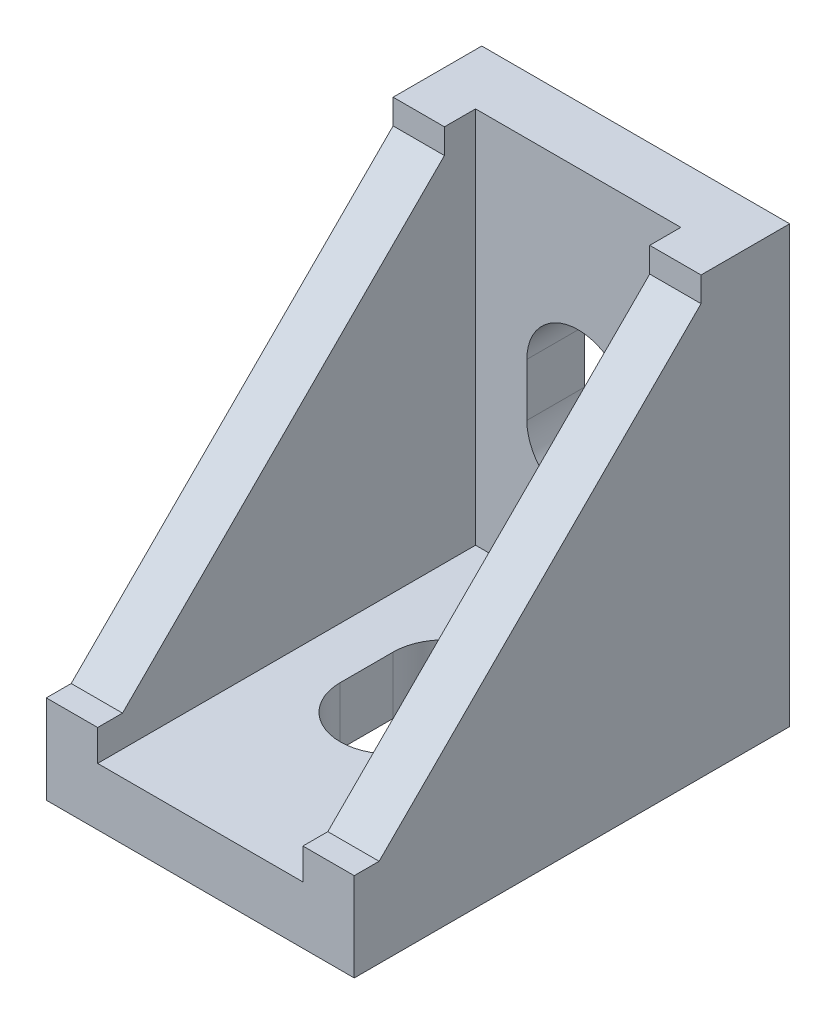
from build123d import *

# Parameters (mm, degrees)
SKETCH1_W           = 19.8
SKETCH1_H           = 28
BOSS_EXTRUDE1_DEPTH = 3.7
SKETCH2_W           = 19.8
SKETCH2_H           = 3.7
BOSS_EXTRUDE2_DEPTH = 24.3
CUT_EXTRUDE1_DEPTH  = 9
BOSS_EXTRUDE3_DEPTH = 3.3
BOSS_EXTRUDE4_DEPTH = 3.3
BOSS_EXTRUDE5_DEPTH = 2.1
BOSS_EXTRUDE6_DEPTH = 1.5


with BuildPart() as part:
    # Sketch1 → Boss-Extrude1 (new body)
    with BuildSketch(Plane.XY):
        with Locations((9.9, 14)):
            Rectangle(SKETCH1_W, SKETCH1_H)
        with BuildLine():
            Line((13.2, 15.7), (13.2, 12.3))
            ThreePointArc((13.2, 12.3), (9.9, 9), (6.6, 12.3))
            Line((6.6, 12.3), (6.6, 15.7))
            ThreePointArc((6.6, 15.7), (9.9, 19), (13.2, 15.7))
        make_face(mode=Mode.SUBTRACT)
    extrude(amount=BOSS_EXTRUDE1_DEPTH)

    # Sketch2 → Boss-Extrude2 (add)
    with BuildSketch(Plane.XY.offset(3.7)):
        with Locations((9.9, 1.85)):
            Rectangle(SKETCH2_W, SKETCH2_H)
    extrude(amount=BOSS_EXTRUDE2_DEPTH)

    # Sketch3 → Cut-Extrude1 (cut)
    with BuildSketch(Plane(origin=(0, 3.7, 0), x_dir=(1, 0, 0), z_dir=(0, 1, 0))):
        with BuildLine():
            Line((13.2, -12.3), (13.2, -15.7))
            ThreePointArc((13.2, -15.7), (9.9, -19), (6.6, -15.7))
            Line((6.6, -15.7), (6.6, -12.3))
            ThreePointArc((6.6, -12.3), (9.9, -9), (13.2, -12.3))
        make_face()
    extrude(amount=-CUT_EXTRUDE1_DEPTH, mode=Mode.SUBTRACT)

    # Sketch4 → Boss-Extrude3 (add)
    with BuildSketch(Plane(origin=(19.8, 0, 0), x_dir=(0, 0, -1), z_dir=(1, 0, 0))):
        Polygon((-3.7, 26.4), (-3.7, 3.7), (-26.4, 3.7), (-28, 3.7), (-28, 5.7), (-26.4, 5.7), (-5.7, 26.4), (-5.7, 28), (-3.7, 28), align=None)
    extrude(amount=-BOSS_EXTRUDE3_DEPTH)

    # Sketch5 → Boss-Extrude4 (add)
    with BuildSketch(Plane.ZY):
        Polygon((3.7, 26), (3.7, 3.7), (26, 3.7), (28, 3.7), (28, 5.7), (26.4, 5.7), (5.7, 26.4), (5.7, 28), (3.7, 28), align=None)
    extrude(amount=-BOSS_EXTRUDE4_DEPTH)

    # Sketch6 → Boss-Extrude5 (add)
    with BuildSketch(Plane(origin=(0, 0, 0), x_dir=(-1, 0, 0), z_dir=(0, -1, 0))):
        with BuildLine():
            Line((-9.3, -25.5), (-10.5, -25.5))
            ThreePointArc((-10.5, -25.5), (-12.1, -23.9), (-10.5, -22.3))
            Line((-10.5, -22.3), (-9.3, -22.3))
            ThreePointArc((-9.3, -22.3), (-7.7, -23.9), (-9.3, -25.5))
        make_face()
        with BuildLine():
            Line((-9.45, -4.2), (-10.35, -4.2))
            ThreePointArc((-10.35, -4.2), (-12.1, -2.45), (-10.35, -0.7))
            Line((-10.35, -0.7), (-9.45, -0.7))
            ThreePointArc((-9.45, -0.7), (-7.7, -2.45), (-9.45, -4.2))
        make_face()
    extrude(amount=BOSS_EXTRUDE5_DEPTH)

    # Sketch7 → Boss-Extrude6 (add)
    with BuildSketch(Plane(origin=(0, 0, 0), x_dir=(-1, 0, 0), z_dir=(0, 0, -1))):
        with BuildLine():
            Line((-10.5, 25.5), (-9.3, 25.5))
            ThreePointArc((-9.3, 25.5), (-7.7, 23.9), (-9.3, 22.3))
            Line((-9.3, 22.3), (-10.5, 22.3))
            ThreePointArc((-10.5, 22.3), (-12.1, 23.9), (-10.5, 25.5))
        make_face()
        with BuildLine():
            Line((-10.35, 4.2), (-9.45, 4.2))
            ThreePointArc((-9.45, 4.2), (-7.7, 2.45), (-9.45, 0.7))
            Line((-9.45, 0.7), (-10.35, 0.7))
            ThreePointArc((-10.35, 0.7), (-12.1, 2.45), (-10.35, 4.2))
        make_face()
    extrude(amount=BOSS_EXTRUDE6_DEPTH)


solid = part.part
